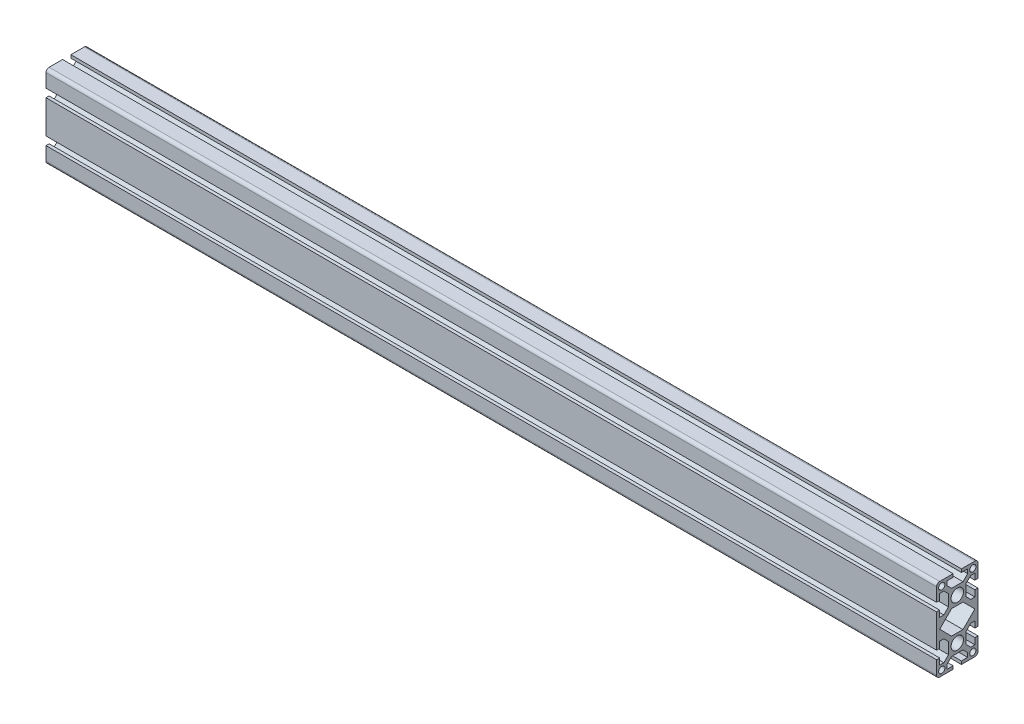
from build123d import *

# Parameters (mm, degrees)
SKETCH1_R           = 6
SKETCH1_R_2         = 3
BOSS_EXTRUDE1_DEPTH = 860


with BuildPart() as part:
    # Sketch1 → Boss-Extrude1 (new body)
    with BuildSketch(Plane(origin=(0, 0, 0), x_dir=(0, 0, -1), z_dir=(1, 0, 0))):
        with BuildLine():
            Line((-20, -4), (-17, -4))
            Line((-17, -4), (-17, -10))
            Line((-17, -10), (-13, -10))
            Line((-13, -10), (-8.5, -5.5))
            Line((-8.5, -5.5), (-8.5, 5.5))
            Line((-8.5, 5.5), (-13, 10))
            Line((-13, 10), (-17, 10))
            Line((-17, 10), (-17, 4))
            Line((-17, 4), (-20, 4))
            Line((-20, 4), (-20, 36))
            Line((-20, 36), (-17, 36))
            Line((-17, 36), (-17, 30))
            Line((-17, 30), (-13, 30))
            Line((-13, 30), (-8.5, 34.5))
            Line((-8.5, 34.5), (-8.5, 45.5))
            Line((-8.5, 45.5), (-13, 50))
            Line((-13, 50), (-17, 50))
            Line((-17, 50), (-17, 44))
            Line((-17, 44), (-20, 44))
            Line((-20, 44), (-20, 57))
            ThreePointArc((-20, 57), (-19.121320344, 59.121320344), (-17, 60))
            Line((-17, 60), (-4, 60))
            Line((-4, 60), (-4, 57))
            Line((-4, 57), (-10, 57))
            Line((-10, 57), (-10, 53))
            Line((-10, 53), (-5.5, 48.5))
            Line((-5.5, 48.5), (5.5, 48.5))
            Line((5.5, 48.5), (10, 53))
            Line((10, 53), (10, 57))
            Line((10, 57), (4, 57))
            Line((4, 57), (4, 60))
            Line((4, 60), (17, 60))
            ThreePointArc((17, 60), (19.121320344, 59.121320344), (20, 57))
            Line((20, 57), (20, 44))
            Line((20, 44), (17, 44))
            Line((17, 44), (17, 50))
            Line((17, 50), (13, 50))
            Line((13, 50), (8.5, 45.5))
            Line((8.5, 45.5), (8.5, 34.5))
            Line((8.5, 34.5), (13, 30))
            Line((13, 30), (17, 30))
            Line((17, 30), (17, 36))
            Line((17, 36), (20, 36))
            Line((20, 36), (20, 20))
            Line((20, 20), (20, 4))
            Line((20, 4), (17, 4))
            Line((17, 4), (17, 10))
            Line((17, 10), (13, 10))
            Line((13, 10), (8.5, 5.5))
            Line((8.5, 5.5), (8.5, -5.5))
            Line((8.5, -5.5), (13, -10))
            Line((13, -10), (17, -10))
            Line((17, -10), (17, -4))
            Line((17, -4), (20, -4))
            Line((20, -4), (20, -17))
            ThreePointArc((20, -17), (19.121320344, -19.121320344), (17, -20))
            Line((17, -20), (4, -20))
            Line((4, -20), (4, -17))
            Line((4, -17), (10, -17))
            Line((10, -17), (10, -13))
            Line((10, -13), (5.5, -8.5))
            Line((5.5, -8.5), (-5.5, -8.5))
            Line((-5.5, -8.5), (-10, -13))
            Line((-10, -13), (-10, -17))
            Line((-10, -17), (-4, -17))
            Line((-4, -17), (-4, -20))
            Line((-4, -20), (-17, -20))
            ThreePointArc((-17, -20), (-19.121320344, -19.121320344), (-20, -17))
            Line((-20, -17), (-20, -4))
        make_face()
        Circle(SKETCH1_R, mode=Mode.SUBTRACT)
        with Locations((-15, -15)):
            Circle(SKETCH1_R_2, mode=Mode.SUBTRACT)
        with Locations((15, 55)):
            Circle(SKETCH1_R_2, mode=Mode.SUBTRACT)
        with Locations((-15, 55)):
            Circle(SKETCH1_R_2, mode=Mode.SUBTRACT)
        with Locations((15, -15)):
            Circle(SKETCH1_R_2, mode=Mode.SUBTRACT)
        with Locations((0, 40)):
            Circle(SKETCH1_R, mode=Mode.SUBTRACT)
        Polygon((-5.5, 8.5), (-17, 20), (-5.5, 31.5), (5.5, 31.5), (17, 20), (5.5, 8.5), align=None, mode=Mode.SUBTRACT)
    extrude(amount=BOSS_EXTRUDE1_DEPTH)


solid = part.part
